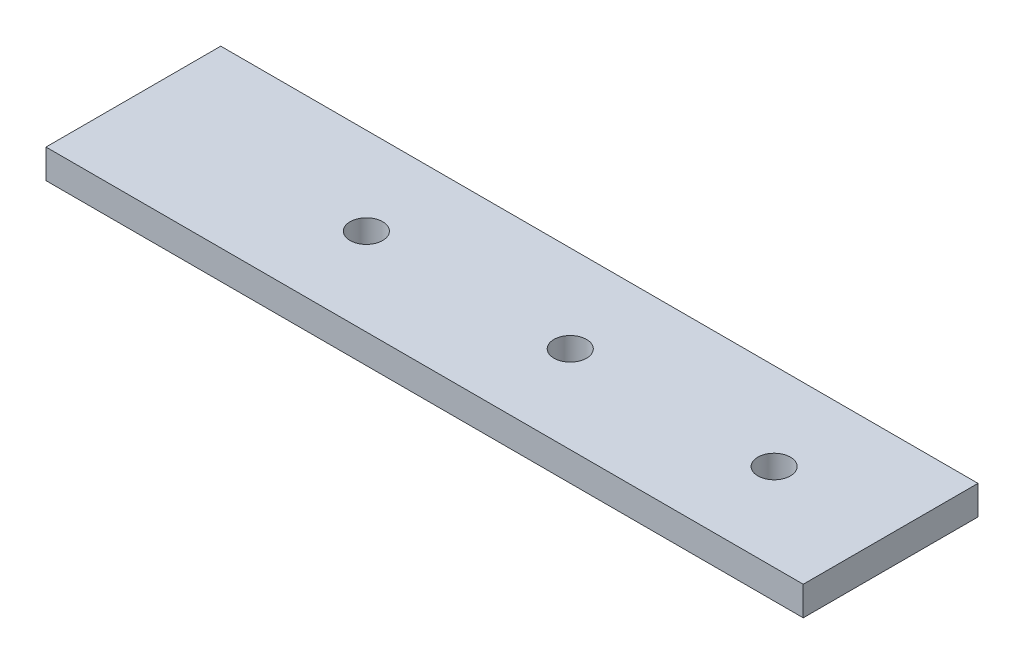
from build123d import *

# Parameters (mm, degrees)
SKETCH1_W           = 65
SKETCH1_H           = 15
SKETCH1_R           = 1.4
BOSS_EXTRUDE1_DEPTH = 2.5


with BuildPart() as part:
    # Sketch1 → Boss-Extrude1 (new body)
    with BuildSketch(Plane(origin=(0, 0, 0), x_dir=(1, 0, 0), z_dir=(0, 1, 0))):
        with Locations((32.5, 7.5)):
            Rectangle(SKETCH1_W, SKETCH1_H)
        with Locations(Location((55, 7.5, 0), (0, 0, 270))):
            Circle(SKETCH1_R, mode=Mode.SUBTRACT)
        with Locations(Location((37.5, 7.5, 0), (0, 0, 270))):
            Circle(SKETCH1_R, mode=Mode.SUBTRACT)
        with Locations(Location((20, 7.5, 0), (0, 0, 270))):
            Circle(SKETCH1_R, mode=Mode.SUBTRACT)
    extrude(amount=BOSS_EXTRUDE1_DEPTH)


solid = part.part
